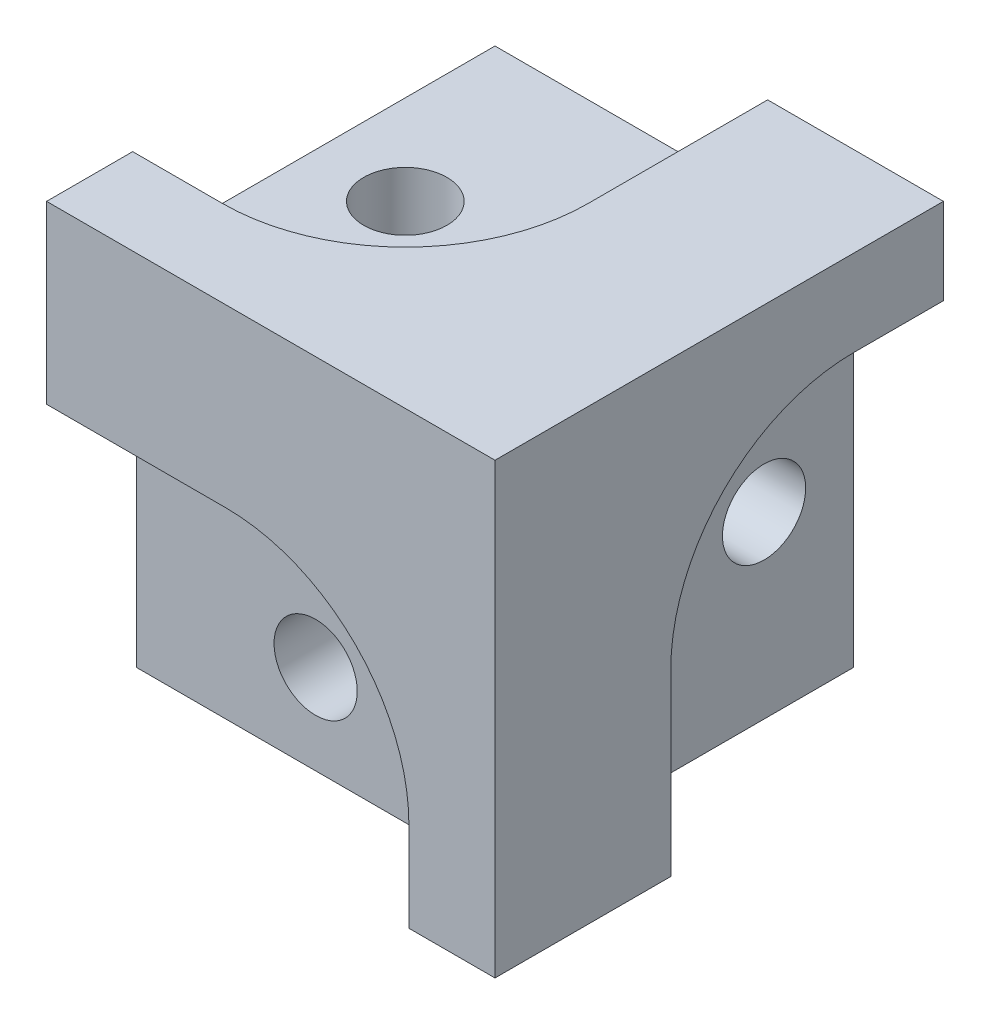
from build123d import *

# Parameters (mm, degrees)
CUBE_BASE_DEPTH       = 7.9375
CUBE_BASE_DEPTH_BACK  = 7.9375
SKETCH2_W             = 15.875
SKETCH2_H             = 15.875
F_4_CLEARANCE_HOLE1_D = 2.9464
FRAME_RELIEF_DEPTH    = 3.175
CIRPATTERN1_COUNT     = 3


with BuildPart() as part:
    # Sketch2 → CUBE-BASE (new, two sides: drawn at the far end of the back side and taken through both)
    with BuildSketch(Plane.XY.offset(-CUBE_BASE_DEPTH_BACK)):
        Rectangle(SKETCH2_W, SKETCH2_H)
    extrude(amount=CUBE_BASE_DEPTH + CUBE_BASE_DEPTH_BACK)

    # #4 Clearance Hole1 (through all)
    with Locations(Plane.XY.offset(7.9375)):
        with Locations((-1.5875, -4.7625)):
            f_4_clearance_hole1 = Hole(F_4_CLEARANCE_HOLE1_D / 2)

    # Sketch5 → FRAME-RELIEF (cut)
    with BuildSketch(Plane.XY.offset(7.9375)):
        with BuildLine():
            Line((-1.5875, 1.7145), (-7.9375, 1.7145))
            Line((-7.9375, 1.7145), (-7.9375, -7.9375))
            Line((-7.9375, -7.9375), (4.8895, -7.9375))
            Line((4.8895, -7.9375), (4.8895, -4.7625))
            ThreePointArc((4.8895, -4.7625), (2.992430622, -0.182569378), (-1.5875, 1.7145))
        make_face()
    frame_relief = extrude(amount=-FRAME_RELIEF_DEPTH, mode=Mode.SUBTRACT)

    # CirPattern1: #4 Clearance Hole1, FRAME-RELIEF ×3 about axis
    cirpattern1_axis = Axis((7.9375, 7.9375, 7.9375), (-0.5773502691896257, -0.5773502691896257, -0.5773502691896257))
    add([f_4_clearance_hole1.rotate(cirpattern1_axis, i * 360 / CIRPATTERN1_COUNT) for i in range(1, CIRPATTERN1_COUNT)], mode=Mode.SUBTRACT)
    add([frame_relief.rotate(cirpattern1_axis, i * 360 / CIRPATTERN1_COUNT) for i in range(1, CIRPATTERN1_COUNT)], mode=Mode.SUBTRACT)


solid = part.part
